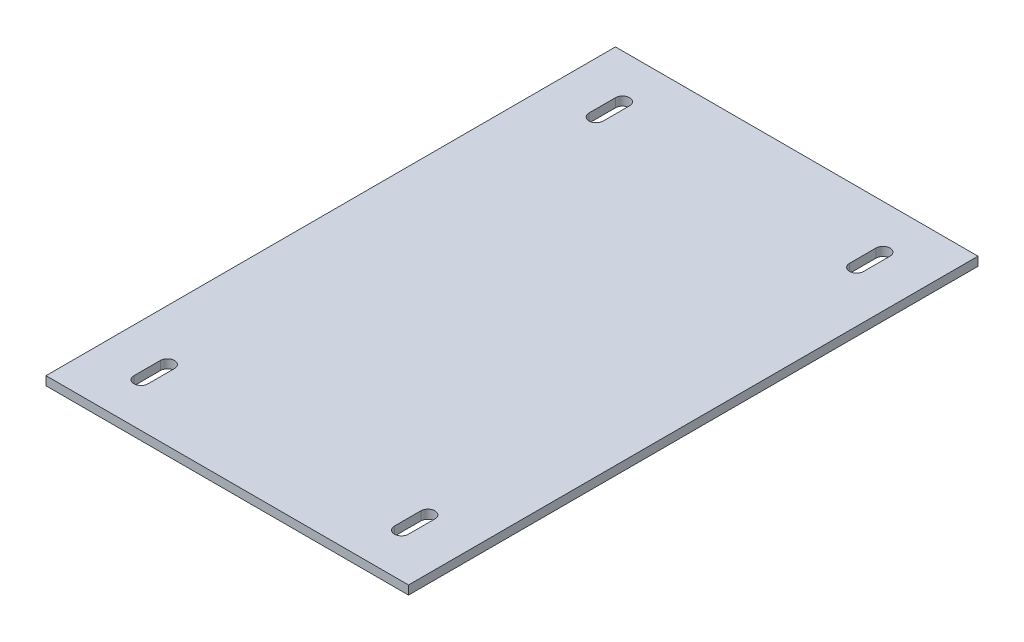
from build123d import *

# Parameters (mm, degrees)
SKETCH1_W           = 206
SKETCH1_H           = 323.61
BOSS_EXTRUDE1_DEPTH = 5


with BuildPart() as part:
    # Sketch1 → Boss-Extrude1 (new body)
    with BuildSketch(Plane(origin=(0, 0, 0), x_dir=(1, 0, 0), z_dir=(0, 1, 0))):
        with Locations((103, 161.805)):
            Rectangle(SKETCH1_W, SKETCH1_H)
        with BuildLine():
            Line((25, 298.61), (25, 283.61))
            ThreePointArc((25, 283.61), (29, 279.61), (33, 283.61))
            Line((33, 283.61), (33, 298.61))
            ThreePointArc((33, 298.61), (29, 302.61), (25, 298.61))
        make_face(mode=Mode.SUBTRACT)
        with BuildLine():
            Line((25, 25), (25, 40))
            ThreePointArc((25, 40), (29, 44), (33, 40))
            Line((33, 40), (33, 25))
            ThreePointArc((33, 25), (29, 21), (25, 25))
        make_face(mode=Mode.SUBTRACT)
        with BuildLine():
            Line((173, 25), (173, 40))
            ThreePointArc((173, 40), (177, 44), (181, 40))
            Line((181, 40), (181, 25))
            ThreePointArc((181, 25), (177, 21), (173, 25))
        make_face(mode=Mode.SUBTRACT)
        with BuildLine():
            Line((173, 298.61), (173, 283.61))
            ThreePointArc((173, 283.61), (177, 279.61), (181, 283.61))
            Line((181, 283.61), (181, 298.61))
            ThreePointArc((181, 298.61), (177, 302.61), (173, 298.61))
        make_face(mode=Mode.SUBTRACT)
    extrude(amount=BOSS_EXTRUDE1_DEPTH)


solid = part.part
